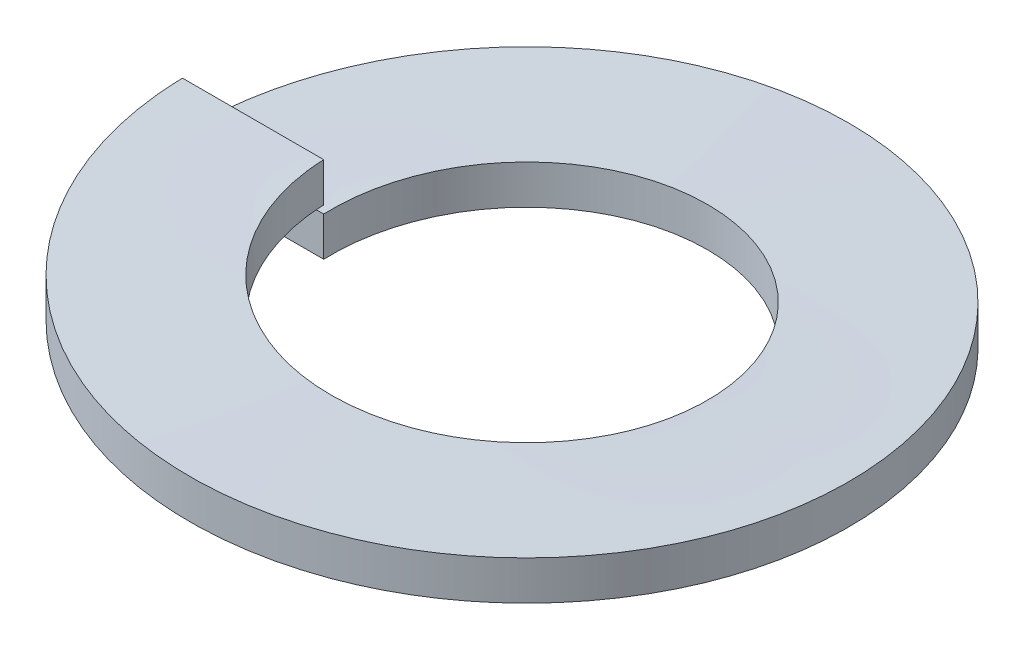
from build123d import *

# Parameters (mm, degrees)
SWEEP1_PITCH       = 1.5
SWEEP1_HEIGHT      = 1.5
SWEEP1_RADIUS      = 10.5
SWEEP1_START_ANGLE = -90
SKETCH3_W          = 4.5
SKETCH3_H          = 1.25


with BuildPart() as part:
    # Sweep1: sweep along a helix
    with BuildLine() as sweep1_path:
        add(Helix(SWEEP1_PITCH, SWEEP1_HEIGHT, SWEEP1_RADIUS, center=(0, 0, 0), direction=(0, 1, 0), lefthand=True, mode=Mode.PRIVATE).rotate(Axis((0, 0, 0), (0, 1, 0)), SWEEP1_START_ANGLE))
    # Sketch3 → Sweep1 (sweep)
    with BuildSketch(Plane.XY):
        with Locations((-8.25, 0.625)):
            Rectangle(SKETCH3_W, SKETCH3_H)
    sweep(path=sweep1_path.line, is_frenet=True)


solid = part.part
